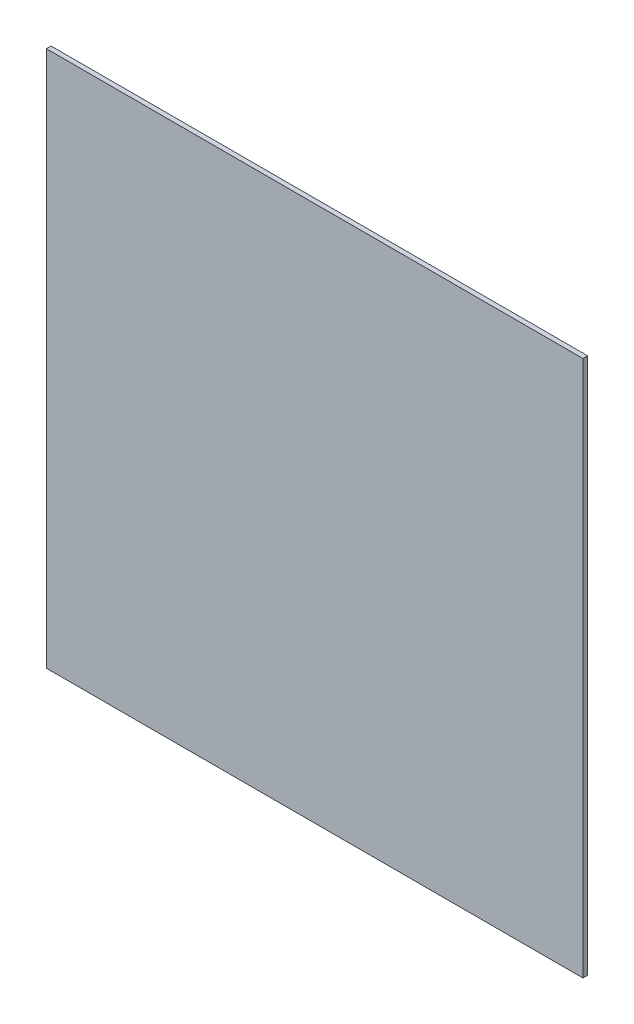
from build123d import *

# Parameters (mm, degrees)
SKETCH1_W           = 137.3
SKETCH1_H           = 137.3
BOSS_EXTRUDE1_DEPTH = 1.2


with BuildPart() as part:
    # Sketch1 → Boss-Extrude1 (new body)
    with BuildSketch(Plane.XY):
        Rectangle(SKETCH1_W, SKETCH1_H)
    extrude(amount=BOSS_EXTRUDE1_DEPTH)


solid = part.part
